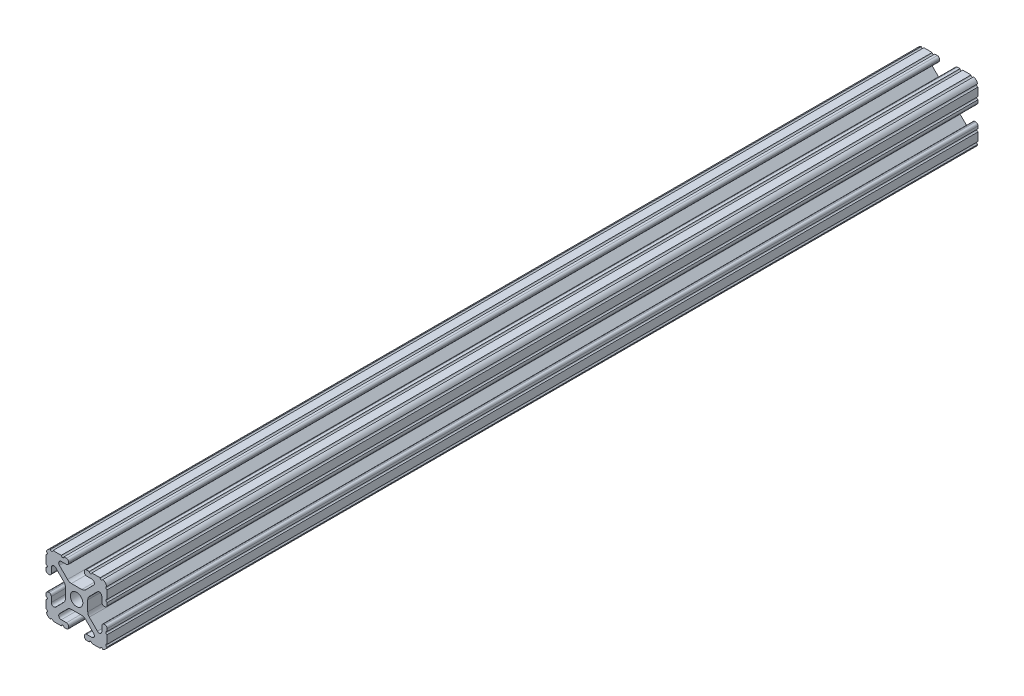
from build123d import *

# Parameters (mm, degrees)
BOSS_EXTRUDE1_DEPTH     = 1524
CUT_EXTRUDE1_DEPTH      = 1525.105829659
CUT_EXTRUDE1_DEPTH_BACK = 1525.105829659
SKETCH5_R               = 0.55245
CUT_EXTRUDE2_DEPTH      = 1525.105829659
CUT_EXTRUDE2_DEPTH_BACK = 1525.105829659
SKETCH8_W               = 50.559993734
SKETCH8_H               = 2698.75


with BuildPart() as part:
    # Sketch4 → Boss-Extrude1 (new, symmetric)
    with BuildSketch(Plane.XY):
        with BuildLine():
            Line((4.190365, -12.7), (10.11729625, -12.7))
            ThreePointArc((10.11729625, -12.7), (11.943543585, -11.943543585), (12.7, -10.11729625))
            Line((12.7, -10.11729625), (12.7, -4.190365))
            ThreePointArc((12.7, -4.190365), (12.42492494, -3.52627506), (11.760835, -3.2512))
            Line((11.760835, -3.2512), (11.429365, -3.2512))
            ThreePointArc((11.429365, -3.2512), (10.76527506, -3.52627506), (10.4902, -4.190365))
            Line((10.4902, -4.190365), (10.4902, -6.348478019))
            ThreePointArc((10.4902, -6.348478019), (9.830707141, -7.335478831), (8.666460301, -7.103895736))
            Line((8.666460301, -7.103895736), (5.299899128, -3.737334563))
            ThreePointArc((5.299899128, -3.737334563), (4.817571085, -3.015479634), (4.6482, -2.16399369))
            Line((4.6482, -2.16399369), (4.6482, 0))
            Line((4.6482, 0), (2.6035, 0))
            ThreePointArc((2.6035, 0), (1.840952505, -1.840952505), (0, -2.6035))
            Line((0, -2.6035), (0, -4.6482))
            Line((0, -4.6482), (2.16399369, -4.6482))
            ThreePointArc((2.16399369, -4.6482), (3.015479634, -4.817571085), (3.737334563, -5.299899128))
            Line((3.737334563, -5.299899128), (7.103895736, -8.666460301))
            ThreePointArc((7.103895736, -8.666460301), (7.335478831, -9.830707141), (6.348478019, -10.4902))
            Line((6.348478019, -10.4902), (4.190365, -10.4902))
            ThreePointArc((4.190365, -10.4902), (3.52627506, -10.76527506), (3.2512, -11.429365))
            Line((3.2512, -11.429365), (3.2512, -11.760835))
            ThreePointArc((3.2512, -11.760835), (3.52627506, -12.42492494), (4.190365, -12.7))
        make_face()
    extrude(amount=BOSS_EXTRUDE1_DEPTH, both=True)

    # Sketch5 → Cut-Extrude1 (cut, two sides: drawn at the far end of the back side and taken through both)
    with BuildSketch(Plane.XY.offset(-CUT_EXTRUDE1_DEPTH_BACK)):
        with Locations((10.356153152, -12.7)):
            Circle(SKETCH5_R)
        with Locations((5.796028019, -12.7)):
            Circle(SKETCH5_R)
        with Locations((12.7, -10.356153152)):
            Circle(SKETCH5_R)
        with Locations((12.7, -5.796028019)):
            Circle(SKETCH5_R)
    extrude(amount=CUT_EXTRUDE1_DEPTH + CUT_EXTRUDE1_DEPTH_BACK, mode=Mode.SUBTRACT)

    # Mirror1: part across plane


with BuildPart() as part_1:
    add(part.part)
    add(part.part.mirror(Plane(origin=(0, 0, 0), x_dir=(0, 0, 1), z_dir=(1, 0, 0))))

    # Mirror2: part across plane


with BuildPart() as part_2:
    add(part_1.part)
    add(part_1.part.mirror(Plane.ZX))

    # Sketch8 → Cut-Extrude2 (cut, two sides: drawn at the far end of the back side and taken through both)
    with BuildSketch(Plane(origin=(0, 0, 0), x_dir=(1, 0, 0), z_dir=(0, 1, 0)).offset(-CUT_EXTRUDE2_DEPTH_BACK)):
        with Locations((0, 187.325)):
            Rectangle(SKETCH8_W, SKETCH8_H)
    extrude(amount=CUT_EXTRUDE2_DEPTH + CUT_EXTRUDE2_DEPTH_BACK, mode=Mode.SUBTRACT)


solid = part_2.part
